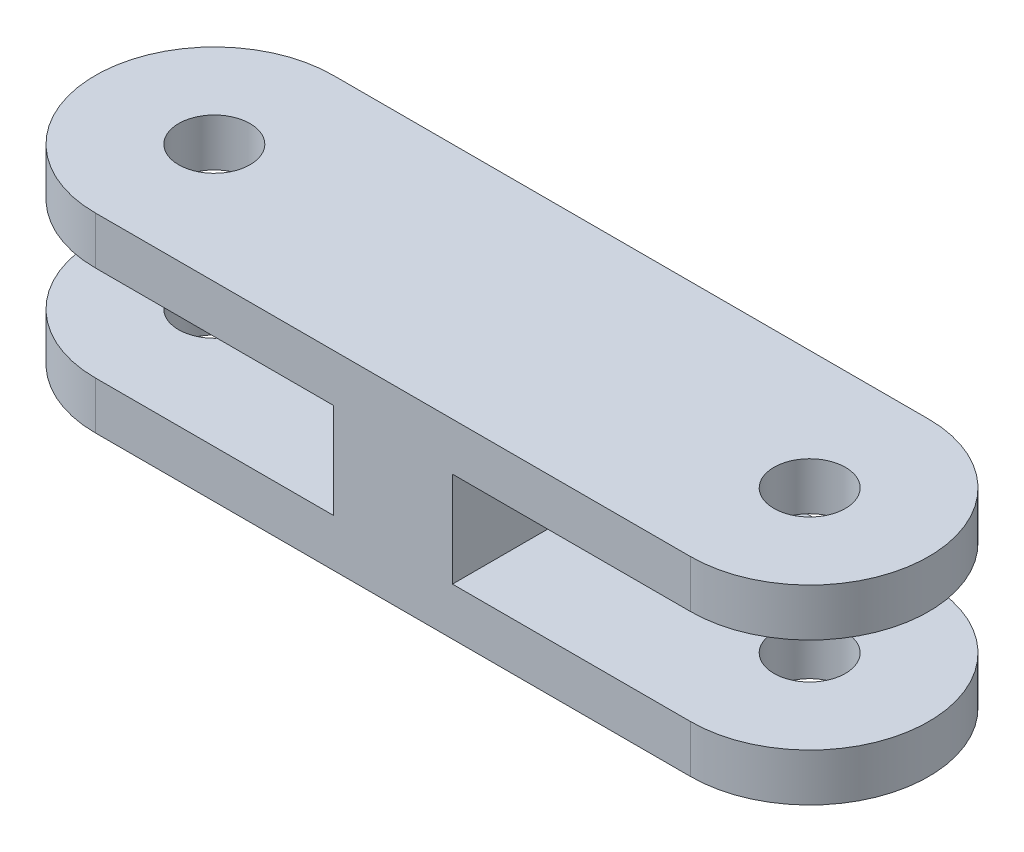
from build123d import *

# Parameters (mm, degrees)
SKETCH_1_R          = 15
EXTRUDE_1_DEPTH     = 80
SKETCH_2_W          = 200
SKETCH_2_H          = 40
CUT_EXTRUDE_1_DEPTH = 125


with BuildPart() as part:
    # 草图1 → 凸台-拉伸1 (new body)
    with BuildSketch(Plane(origin=(0, 0, 0), x_dir=(1, 0, 0), z_dir=(0, 1, 0))):
        with BuildLine():
            Line((-125, 50), (125, 50))
            ThreePointArc((125, 50), (175, 0), (125, -50))
            Line((125, -50), (-125, -50))
            ThreePointArc((-125, -50), (-175, 0), (-125, 50))
        make_face()
        with Locations(Location((-125, 0, 0), (0, 0, 270))):
            Circle(SKETCH_1_R, mode=Mode.SUBTRACT)
        with Locations(Location((125, 0, 0), (0, 0, 270))):
            Circle(SKETCH_1_R, mode=Mode.SUBTRACT)
    extrude(amount=EXTRUDE_1_DEPTH)

    # 草图2 → 切除-拉伸1 (cut)
    with BuildSketch(Plane.XY.offset(50)):
        with Locations((-125, 40)):
            Rectangle(SKETCH_2_W, SKETCH_2_H)
        with Locations((125, 40)):
            Rectangle(SKETCH_2_W, SKETCH_2_H)
    extrude(amount=-CUT_EXTRUDE_1_DEPTH, mode=Mode.SUBTRACT)


solid = part.part
